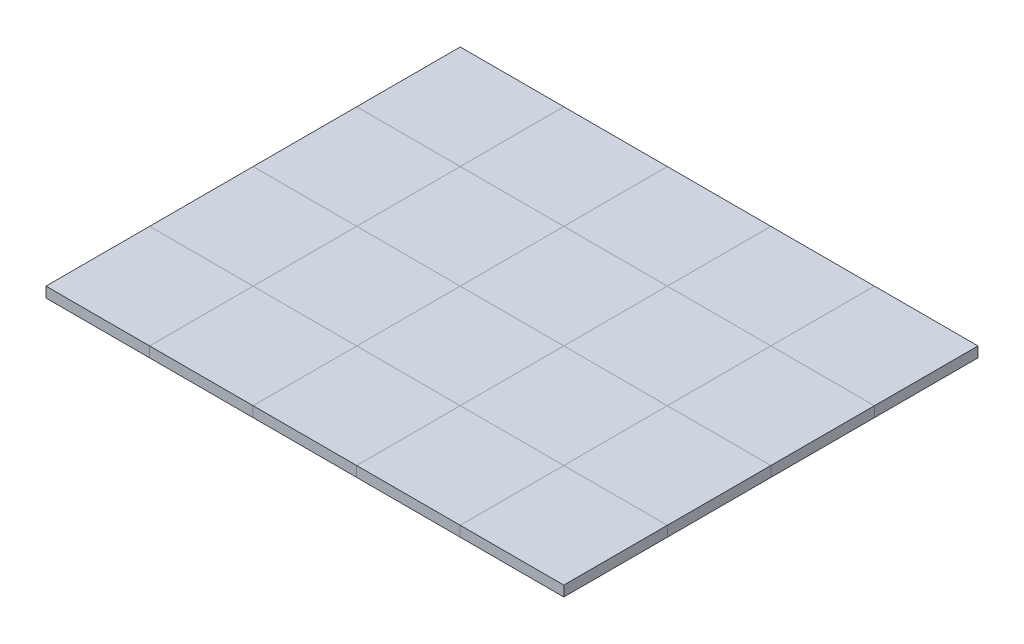
from build123d import *

# Parameters (mm, degrees)
SKETCH1_W           = 50
SKETCH1_H           = 50
BOSS_EXTRUDE1_DEPTH = 5
LPATTERN1_COUNT     = 5
LPATTERN1_PITCH     = 50
LPATTERN1_2_COUNT   = 4
LPATTERN1_2_PITCH   = 50


with BuildPart() as part:
    # Sketch1 → Boss-Extrude1 (new body)
    with BuildSketch(Plane(origin=(0, 0, 0), x_dir=(1, 0, 0), z_dir=(0, 1, 0))):
        with Locations((25, 25)):
            Rectangle(SKETCH1_W, SKETCH1_H)
    extrude(amount=BOSS_EXTRUDE1_DEPTH)


with BuildPart() as lpattern1_1:
    # LPattern1: pattern copy
    add(part.part.moved(Location(Vector(1, 0, 0) * (1 * LPATTERN1_PITCH))))


with BuildPart() as lpattern1_2:
    # LPattern1: pattern copy
    add(part.part.moved(Location(Vector(1, 0, 0) * (2 * LPATTERN1_PITCH))))


with BuildPart() as lpattern1_3:
    # LPattern1: pattern copy
    add(part.part.moved(Location(Vector(1, 0, 0) * (3 * LPATTERN1_PITCH))))


with BuildPart() as lpattern1_4:
    # LPattern1: pattern copy
    add(part.part.moved(Location(Vector(1, 0, 0) * (4 * LPATTERN1_PITCH))))


with BuildPart() as lpattern1_2_1:
    # LPattern1 2: pattern copy
    add(part.part.moved(Location(Vector(0, 0, -1) * (1 * LPATTERN1_2_PITCH))))


with BuildPart() as lpattern1_2_2:
    # LPattern1 2: pattern copy
    add(part.part.moved(Location(Vector(0, 0, -1) * (2 * LPATTERN1_2_PITCH))))


with BuildPart() as lpattern1_2_3:
    # LPattern1 2: pattern copy
    add(part.part.moved(Location(Vector(0, 0, -1) * (3 * LPATTERN1_2_PITCH))))


with BuildPart() as lpattern1_2_4:
    # LPattern1 2: pattern copy
    add(lpattern1_1.part.moved(Location(Vector(0, 0, -1) * (1 * LPATTERN1_2_PITCH))))


with BuildPart() as lpattern1_2_5:
    # LPattern1 2: pattern copy
    add(lpattern1_1.part.moved(Location(Vector(0, 0, -1) * (2 * LPATTERN1_2_PITCH))))


with BuildPart() as lpattern1_2_6:
    # LPattern1 2: pattern copy
    add(lpattern1_1.part.moved(Location(Vector(0, 0, -1) * (3 * LPATTERN1_2_PITCH))))


with BuildPart() as lpattern1_2_7:
    # LPattern1 2: pattern copy
    add(lpattern1_2.part.moved(Location(Vector(0, 0, -1) * (1 * LPATTERN1_2_PITCH))))


with BuildPart() as lpattern1_2_8:
    # LPattern1 2: pattern copy
    add(lpattern1_2.part.moved(Location(Vector(0, 0, -1) * (2 * LPATTERN1_2_PITCH))))


with BuildPart() as lpattern1_2_9:
    # LPattern1 2: pattern copy
    add(lpattern1_2.part.moved(Location(Vector(0, 0, -1) * (3 * LPATTERN1_2_PITCH))))


with BuildPart() as lpattern1_2_10:
    # LPattern1 2: pattern copy
    add(lpattern1_3.part.moved(Location(Vector(0, 0, -1) * (1 * LPATTERN1_2_PITCH))))


with BuildPart() as lpattern1_2_11:
    # LPattern1 2: pattern copy
    add(lpattern1_3.part.moved(Location(Vector(0, 0, -1) * (2 * LPATTERN1_2_PITCH))))


with BuildPart() as lpattern1_2_12:
    # LPattern1 2: pattern copy
    add(lpattern1_3.part.moved(Location(Vector(0, 0, -1) * (3 * LPATTERN1_2_PITCH))))


with BuildPart() as lpattern1_2_13:
    # LPattern1 2: pattern copy
    add(lpattern1_4.part.moved(Location(Vector(0, 0, -1) * (1 * LPATTERN1_2_PITCH))))


with BuildPart() as lpattern1_2_14:
    # LPattern1 2: pattern copy
    add(lpattern1_4.part.moved(Location(Vector(0, 0, -1) * (2 * LPATTERN1_2_PITCH))))


with BuildPart() as lpattern1_2_15:
    # LPattern1 2: pattern copy
    add(lpattern1_4.part.moved(Location(Vector(0, 0, -1) * (3 * LPATTERN1_2_PITCH))))


solid = Compound([part.part, lpattern1_1.part, lpattern1_2.part, lpattern1_3.part, lpattern1_4.part, lpattern1_2_1.part, lpattern1_2_2.part, lpattern1_2_3.part, lpattern1_2_4.part, lpattern1_2_5.part, lpattern1_2_6.part, lpattern1_2_7.part, lpattern1_2_8.part, lpattern1_2_9.part, lpattern1_2_10.part, lpattern1_2_11.part, lpattern1_2_12.part, lpattern1_2_13.part, lpattern1_2_14.part, lpattern1_2_15.part])
